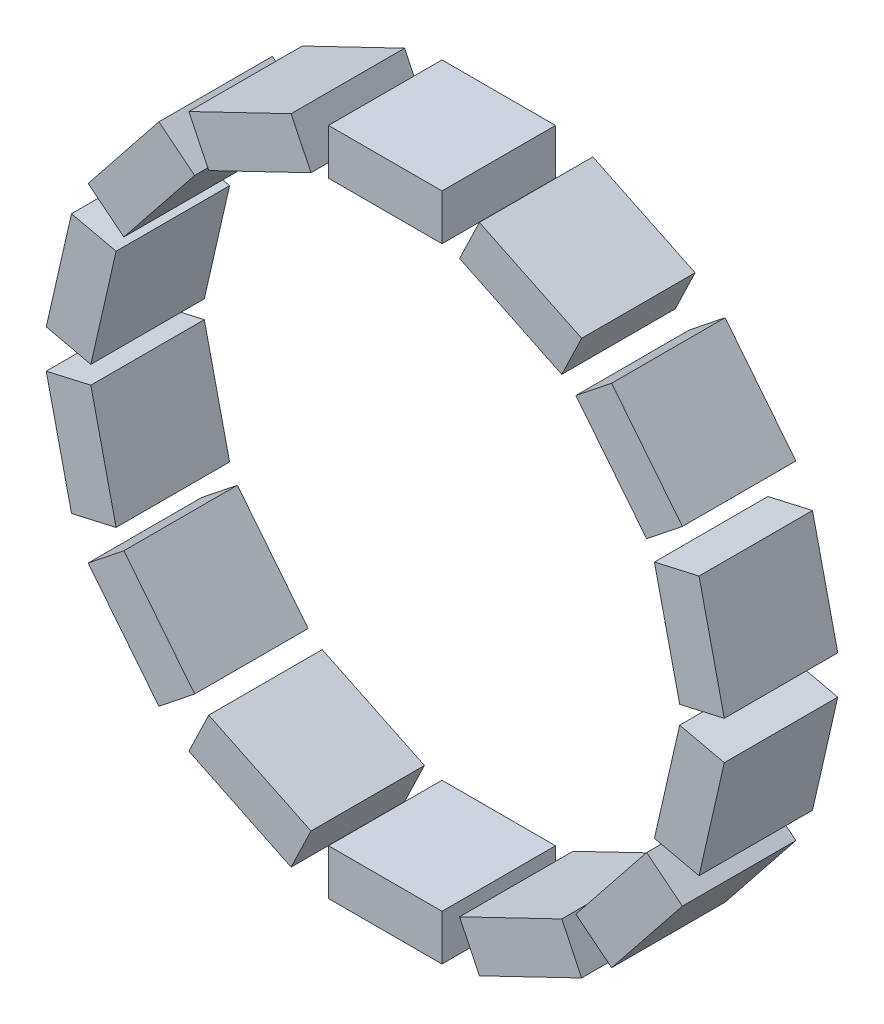
from build123d import *

# Parameters (mm, degrees)
EXTRUDE3_DEPTH    = 4.9784
SKETCH1_W         = 4.9784
SKETCH1_H         = 2.0066
EXTRUDE3_2_DEPTH  = 4.9784
EXTRUDE3_3_DEPTH  = 4.9784
EXTRUDE3_4_DEPTH  = 4.9784
EXTRUDE3_5_DEPTH  = 4.9784
EXTRUDE3_6_DEPTH  = 4.9784
EXTRUDE3_7_DEPTH  = 4.9784
EXTRUDE3_8_DEPTH  = 4.9784
EXTRUDE3_9_DEPTH  = 4.9784
EXTRUDE3_10_DEPTH = 4.9784
EXTRUDE3_11_DEPTH = 4.9784
EXTRUDE3_12_DEPTH = 4.9784
EXTRUDE3_13_DEPTH = 4.9784
EXTRUDE3_14_DEPTH = 4.9784


with BuildPart() as part:
    # Sketch1 → Extrude3 (new body)
    with BuildSketch(Plane.XY):
        Polygon((3.259415729, 12.505267218), (7.744799141, 10.345220411), (8.615430252, 12.153104541), (4.13004684, 14.313151348), align=None)
    extrude(amount=EXTRUDE3_DEPTH)


with BuildPart() as body_2:
    # Sketch1 → Extrude3 2 (new body)
    with BuildSketch(Plane.XY):
        with Locations((0, 13.684363932)):
            Rectangle(SKETCH1_W, SKETCH1_H)
    extrude(amount=EXTRUDE3_2_DEPTH)


with BuildPart() as body_3:
    # Sketch1 → Extrude3 3 (new body)
    with BuildSketch(Plane.XY):
        Polygon((8.362464198, 9.852648964), (11.466445828, 5.960379112), (13.03526888, 7.211473748), (9.931287251, 11.103743601), align=None)
    extrude(amount=EXTRUDE3_3_DEPTH)


with BuildPart() as body_4:
    # Sketch1 → Extrude3 4 (new body)
    with BuildSketch(Plane.XY):
        Polygon((11.809224074, 5.248592749), (12.917022292, 0.395011631), (14.873312641, 0.841522137), (13.765514423, 5.695103255), align=None)
    extrude(amount=EXTRUDE3_4_DEPTH)


with BuildPart() as body_5:
    # Sketch1 → Extrude3 5 (new body)
    with BuildSketch(Plane.XY):
        Polygon((12.917022292, -0.395011631), (11.809224074, -5.248592749), (13.765514423, -5.695103255), (14.873312641, -0.841522137), align=None)
    extrude(amount=EXTRUDE3_5_DEPTH)


with BuildPart() as body_6:
    # Sketch1 → Extrude3 6 (new body)
    with BuildSketch(Plane.XY):
        Polygon((11.466445828, -5.960379112), (8.362464198, -9.852648964), (9.931287251, -11.103743601), (13.03526888, -7.211473748), align=None)
    extrude(amount=EXTRUDE3_6_DEPTH)


with BuildPart() as body_7:
    # Sketch1 → Extrude3 7 (new body)
    with BuildSketch(Plane.XY):
        Polygon((7.744799141, -10.345220411), (3.259415729, -12.505267218), (4.13004684, -14.313151348), (8.615430252, -12.153104541), align=None)
    extrude(amount=EXTRUDE3_7_DEPTH)


with BuildPart() as body_8:
    # Sketch1 → Extrude3 8 (new body)
    with BuildSketch(Plane.XY):
        with Locations((0, -13.684363932)):
            Rectangle(SKETCH1_W, SKETCH1_H)
    extrude(amount=EXTRUDE3_8_DEPTH)


with BuildPart() as body_9:
    # Sketch1 → Extrude3 9 (new body)
    with BuildSketch(Plane.XY):
        Polygon((-3.259415729, -12.505267218), (-7.744799141, -10.345220411), (-8.615430252, -12.153104541), (-4.13004684, -14.313151348), align=None)
    extrude(amount=EXTRUDE3_9_DEPTH)


with BuildPart() as body_10:
    # Sketch1 → Extrude3 10 (new body)
    with BuildSketch(Plane.XY):
        Polygon((-8.362464198, -9.852648964), (-11.466445828, -5.960379112), (-13.03526888, -7.211473748), (-9.931287251, -11.103743601), align=None)
    extrude(amount=EXTRUDE3_10_DEPTH)


with BuildPart() as body_11:
    # Sketch1 → Extrude3 11 (new body)
    with BuildSketch(Plane.XY):
        Polygon((-11.809224074, -5.248592749), (-12.917022292, -0.395011631), (-14.873312641, -0.841522137), (-13.765514423, -5.695103255), align=None)
    extrude(amount=EXTRUDE3_11_DEPTH)


with BuildPart() as body_12:
    # Sketch1 → Extrude3 12 (new body)
    with BuildSketch(Plane.XY):
        Polygon((-12.917022292, 0.395011631), (-11.809224074, 5.248592749), (-13.765514423, 5.695103255), (-14.873312641, 0.841522137), align=None)
    extrude(amount=EXTRUDE3_12_DEPTH)


with BuildPart() as body_13:
    # Sketch1 → Extrude3 13 (new body)
    with BuildSketch(Plane.XY):
        Polygon((-11.466445828, 5.960379112), (-8.362464198, 9.852648964), (-9.931287251, 11.103743601), (-13.03526888, 7.211473748), align=None)
    extrude(amount=EXTRUDE3_13_DEPTH)


with BuildPart() as body_14:
    # Sketch1 → Extrude3 14 (new body)
    with BuildSketch(Plane.XY):
        Polygon((-7.744799141, 10.345220411), (-3.259415729, 12.505267218), (-4.13004684, 14.313151348), (-8.615430252, 12.153104541), align=None)
    extrude(amount=EXTRUDE3_14_DEPTH)


solid = Compound([part.part, body_2.part, body_3.part, body_4.part, body_5.part, body_6.part, body_7.part, body_8.part, body_9.part, body_10.part, body_11.part, body_12.part, body_13.part, body_14.part])
